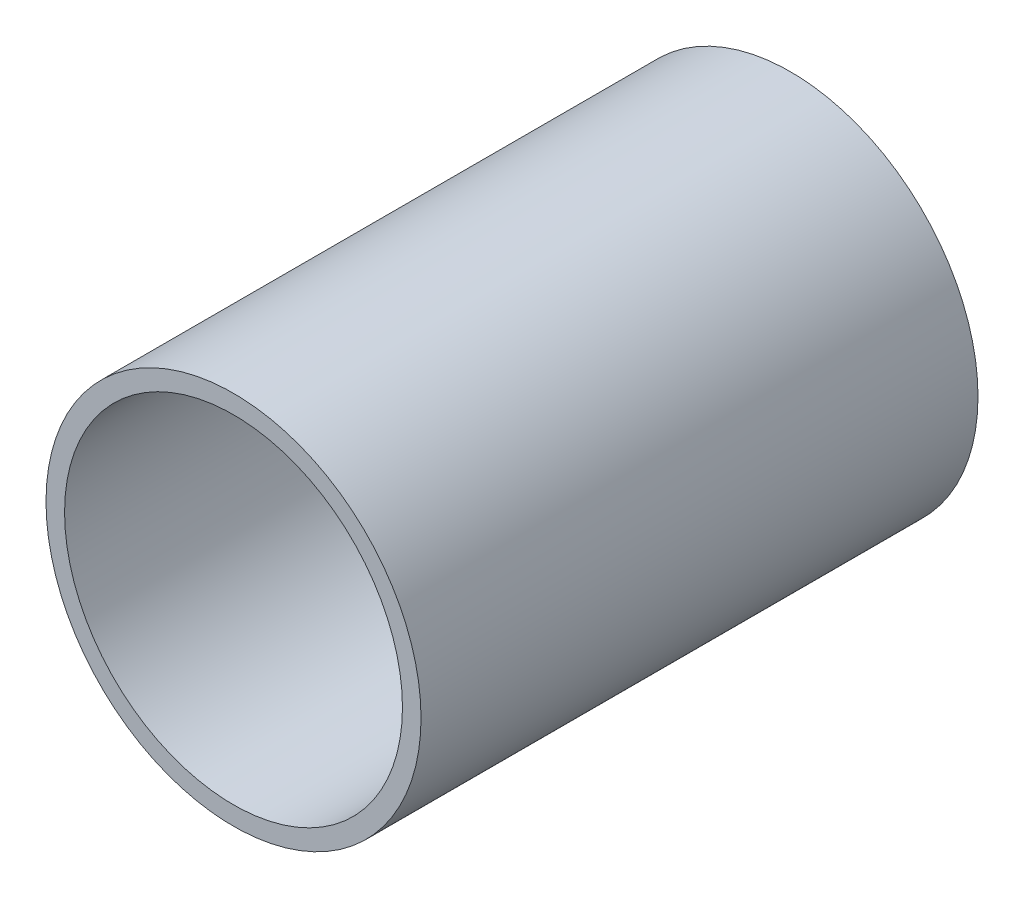
from build123d import *

# Parameters (mm, degrees)
SKETCH_1_R      = 10.1
SKETCH_1_R_2    = 9.1
EXTRUDE_1_DEPTH = 30


with BuildPart() as part:
    # Эскиз1 → Бобышка-Вытянуть1 (new body)
    with BuildSketch(Plane.XY):
        Circle(SKETCH_1_R)
        Circle(SKETCH_1_R_2, mode=Mode.SUBTRACT)
    extrude(amount=EXTRUDE_1_DEPTH)


solid = part.part
